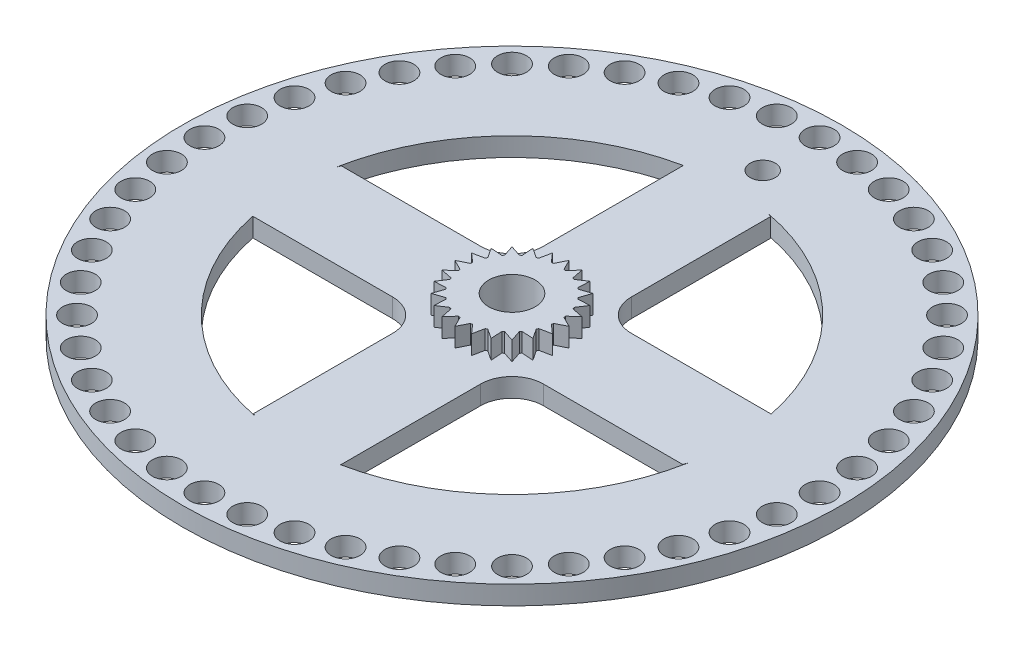
from build123d import *

# Parameters (mm, degrees)
SKETCH1_R               = 26.25
BOSS_EXTRUDE1_DEPTH     = 1.5
SKETCH2_R               = 17.5
CUT_EXTRUDE1_DEPTH      = 4.5
SKETCH3_R               = 1.15
CUT_EXTRUDE2_DEPTH      = 2.5
SKETCH5_R               = 1
CUT_EXTRUDE3_DEPTH      = 1.5
BOSS_EXTRUDE4_DEPTH     = 1.5
SKETCH12_R              = 3.75
BOSS_EXTRUDE6_DEPTH     = 1.5
CUT_EXTRUDE4_DEPTH      = 11
CUT_EXTRUDE4_DEPTH_BACK = 1.5
SKETCH7_R               = 1.85
BOSS_EXTRUDE8_DEPTH     = 1.5


with BuildPart() as part:
    # Sketch1 → Boss-Extrude1 (new body)
    with BuildSketch(Plane(origin=(0, 0, 0), x_dir=(1, 0, 0), z_dir=(0, 1, 0))):
        with Locations(Location((0, 0, 0), (0, 0, 270))):
            Circle(SKETCH1_R)
    extrude(amount=BOSS_EXTRUDE1_DEPTH)

    # Sketch2 → Cut-Extrude1 (cut)
    with BuildSketch(Plane(origin=(0, 1.5, 0), x_dir=(1, 0, 0), z_dir=(0, 1, 0))):
        with Locations(Location((0, 0, 0), (0, 0, 270))):
            Circle(SKETCH2_R)
    extrude(amount=-CUT_EXTRUDE1_DEPTH, mode=Mode.SUBTRACT)

    # Sketch3 → Cut-Extrude2 (cut)
    with BuildSketch(Plane(origin=(0, 1.5, 0), x_dir=(1, 0, 0), z_dir=(0, 1, 0))):
        with Locations(Location((0, 24.5, 0), (0, 0, 270))):
            Circle(SKETCH3_R)
        with Locations(Location((3.197891709, 24.290399104, 0), (0, 0, 270))):
            Circle(SKETCH3_R)
        with Locations(Location((6.341066605, 23.665182744, 0), (0, 0, 270))):
            Circle(SKETCH3_R)
        with Locations(Location((9.375744093, 22.635048547, 0), (0, 0, 270))):
            Circle(SKETCH3_R)
        with Locations(Location((12.25, 21.217622393, 0), (0, 0, 270))):
            Circle(SKETCH3_R)
        with Locations(Location((14.914655011, 19.437156837, 0), (0, 0, 270))):
            Circle(SKETCH3_R)
        with Locations(Location((17.324116139, 17.324116139, 0), (0, 0, 270))):
            Circle(SKETCH3_R)
        with Locations(Location((19.437156837, 14.914655011, 0), (0, 0, 270))):
            Circle(SKETCH3_R)
        with Locations(Location((21.217622393, 12.25, 0), (0, 0, 270))):
            Circle(SKETCH3_R)
        with Locations(Location((22.635048547, 9.375744093, 0), (0, 0, 270))):
            Circle(SKETCH3_R)
        with Locations(Location((23.665182744, 6.341066605, 0), (0, 0, 270))):
            Circle(SKETCH3_R)
        with Locations(Location((24.290399104, 3.197891709, 0), (0, 0, 270))):
            Circle(SKETCH3_R)
        with Locations(Location((24.5, 0, 0), (0, 0, 270))):
            Circle(SKETCH3_R)
        with Locations(Location((24.290399104, -3.197891709, 0), (0, 0, 270))):
            Circle(SKETCH3_R)
        with Locations(Location((23.665182744, -6.341066605, 0), (0, 0, 270))):
            Circle(SKETCH3_R)
        with Locations(Location((22.635048547, -9.375744093, 0), (0, 0, 270))):
            Circle(SKETCH3_R)
        with Locations(Location((21.217622393, -12.25, 0), (0, 0, 270))):
            Circle(SKETCH3_R)
        with Locations(Location((19.437156837, -14.914655011, 0), (0, 0, 270))):
            Circle(SKETCH3_R)
        with Locations(Location((17.324116139, -17.324116139, 0), (0, 0, 270))):
            Circle(SKETCH3_R)
        with Locations(Location((14.914655011, -19.437156837, 0), (0, 0, 270))):
            Circle(SKETCH3_R)
        with Locations(Location((12.25, -21.217622393, 0), (0, 0, 270))):
            Circle(SKETCH3_R)
        with Locations(Location((9.375744093, -22.635048547, 0), (0, 0, 270))):
            Circle(SKETCH3_R)
        with Locations(Location((6.341066605, -23.665182744, 0), (0, 0, 270))):
            Circle(SKETCH3_R)
        with Locations(Location((3.197891709, -24.290399104, 0), (0, 0, 270))):
            Circle(SKETCH3_R)
        with Locations(Location((0, -24.5, 0), (0, 0, 270))):
            Circle(SKETCH3_R)
        with Locations(Location((-3.197891709, -24.290399104, 0), (0, 0, 270))):
            Circle(SKETCH3_R)
        with Locations(Location((-6.341066605, -23.665182744, 0), (0, 0, 270))):
            Circle(SKETCH3_R)
        with Locations(Location((-9.375744093, -22.635048547, 0), (0, 0, 270))):
            Circle(SKETCH3_R)
        with Locations(Location((-12.25, -21.217622393, 0), (0, 0, 270))):
            Circle(SKETCH3_R)
        with Locations(Location((-14.914655011, -19.437156837, 0), (0, 0, 270))):
            Circle(SKETCH3_R)
        with Locations(Location((-17.324116139, -17.324116139, 0), (0, 0, 270))):
            Circle(SKETCH3_R)
        with Locations(Location((-19.437156837, -14.914655011, 0), (0, 0, 270))):
            Circle(SKETCH3_R)
        with Locations(Location((-21.217622393, -12.25, 0), (0, 0, 270))):
            Circle(SKETCH3_R)
        with Locations(Location((-22.635048547, -9.375744093, 0), (0, 0, 270))):
            Circle(SKETCH3_R)
        with Locations(Location((-23.665182744, -6.341066605, 0), (0, 0, 270))):
            Circle(SKETCH3_R)
        with Locations(Location((-24.290399104, -3.197891709, 0), (0, 0, 270))):
            Circle(SKETCH3_R)
        with Locations(Location((-24.5, 0, 0), (0, 0, 270))):
            Circle(SKETCH3_R)
        with Locations(Location((-24.290399104, 3.197891709, 0), (0, 0, 270))):
            Circle(SKETCH3_R)
        with Locations(Location((-23.665182744, 6.341066605, 0), (0, 0, 270))):
            Circle(SKETCH3_R)
        with Locations(Location((-22.635048547, 9.375744093, 0), (0, 0, 270))):
            Circle(SKETCH3_R)
        with Locations(Location((-21.217622393, 12.25, 0), (0, 0, 270))):
            Circle(SKETCH3_R)
        with Locations(Location((-19.437156837, 14.914655011, 0), (0, 0, 270))):
            Circle(SKETCH3_R)
        with Locations(Location((-17.324116139, 17.324116139, 0), (0, 0, 270))):
            Circle(SKETCH3_R)
        with Locations(Location((-14.914655011, 19.437156837, 0), (0, 0, 270))):
            Circle(SKETCH3_R)
        with Locations(Location((-12.25, 21.217622393, 0), (0, 0, 270))):
            Circle(SKETCH3_R)
        with Locations(Location((-9.375744093, 22.635048547, 0), (0, 0, 270))):
            Circle(SKETCH3_R)
        with Locations(Location((-6.341066605, 23.665182744, 0), (0, 0, 270))):
            Circle(SKETCH3_R)
        with Locations(Location((-3.197891709, 24.290399104, 0), (0, 0, 270))):
            Circle(SKETCH3_R)
    extrude(amount=-CUT_EXTRUDE2_DEPTH, mode=Mode.SUBTRACT)

    # Sketch5 → Cut-Extrude3 (cut)
    with BuildSketch(Plane(origin=(0, 1.5, 0), x_dir=(1, 0, 0), z_dir=(0, 1, 0))):
        with Locations(Location((0, 19.972095444, 0), (0, 0, 270))):
            Circle(SKETCH5_R)
    extrude(amount=-CUT_EXTRUDE3_DEPTH, mode=Mode.SUBTRACT)

    # Sketch6 → Boss-Extrude4 (add)
    with BuildSketch(Plane(origin=(0, 1.5, 0), x_dir=(1, 0, 0), z_dir=(0, 1, 0))):
        with BuildLine():
            Line((-3.5, 6), (-3.5, 17.146428199))
            Line((-3.5, 17.146428199), (0, 18.447450685))
            Line((0, 18.447450685), (3.5, 17.094189414))
            Line((3.5, 17.094189414), (3.5, 6))
            ThreePointArc((3.5, 6), (4.232233047, 4.232233047), (6, 3.5))
            Line((6, 3.5), (17.146428199, 3.5))
            Line((17.146428199, 3.5), (18.447450685, 0))
            Line((18.447450685, 0), (17.094189414, -3.5))
            Line((17.094189414, -3.5), (6, -3.5))
            ThreePointArc((6, -3.5), (4.232233047, -4.232233047), (3.5, -6))
            Line((3.5, -6), (3.5, -17.146428199))
            Line((3.5, -17.146428199), (0, -18.447450685))
            Line((0, -18.447450685), (-3.5, -17.094189414))
            Line((-3.5, -17.094189414), (-3.5, -6))
            ThreePointArc((-3.5, -6), (-4.232233047, -4.232233047), (-6, -3.5))
            Line((-6, -3.5), (-17.146428199, -3.5))
            Line((-17.146428199, -3.5), (-18.447450685, 0))
            Line((-18.447450685, 0), (-17.094189414, 3.5))
            Line((-17.094189414, 3.5), (-6, 3.5))
            ThreePointArc((-6, 3.5), (-4.232233047, 4.232233047), (-3.5, 6))
        make_face()
    extrude(amount=-BOSS_EXTRUDE4_DEPTH)

    # Sketch12 → Boss-Extrude6 (add)
    with BuildSketch(Plane(origin=(0, 1.5, 0), x_dir=(1, 0, 0), z_dir=(0, 1, 0))):
        with Locations(Location((0, 0, 0), (0, 0, 270))):
            Circle(SKETCH12_R)
    extrude(amount=BOSS_EXTRUDE6_DEPTH)

    # Sketch7 → Cut-Extrude4 (cut, two sides: drawn at the far end of the back side and taken through both)
    with BuildSketch(Plane(origin=(0, 1.5, 0), x_dir=(1, 0, 0), z_dir=(0, 1, 0)).offset(-CUT_EXTRUDE4_DEPTH_BACK)):
        with Locations(Location((0, 0, 0), (0, 0, 270))):
            Circle(SKETCH7_R)
    extrude(amount=CUT_EXTRUDE4_DEPTH + CUT_EXTRUDE4_DEPTH_BACK, mode=Mode.SUBTRACT)

    # Sketch15 → Boss-Extrude8 (add)
    with BuildSketch(Plane(origin=(0, 1.5, 0), x_dir=(1, 0, 0), z_dir=(0, 1, 0))):
        with BuildLine():
            Line((0.411312668, 3.727374664), (0, 4.55))
            Line((0, 4.55), (-0.411312668, 3.727374664))
            ThreePointArc((-0.411312668, 3.727374664), (0, 3.75), (0.411312668, 3.727374664))
        make_face()
        with BuildLine():
            Line((1.177626655, 4.39496251), (0.567418023, 3.706823005))
            ThreePointArc((0.567418023, 3.706823005), (0.970571419, 3.622221849), (1.36201308, 3.493911901))
            Line((1.36201308, 3.493911901), (1.177626655, 4.39496251))
        make_face()
        with BuildLine():
            ThreePointArc((-1.36201308, 3.493911901), (-0.970571419, 3.622221849), (-0.567418023, 3.706823005))
            Line((-0.567418023, 3.706823005), (-1.177626655, 4.39496251))
            Line((-1.177626655, 4.39496251), (-1.36201308, 3.493911901))
        make_face()
        with BuildLine():
            Line((2.275, 3.940415587), (1.507480113, 3.433657483))
            ThreePointArc((1.507480113, 3.433657483), (1.875, 3.247595264), (2.219894551, 3.022344815))
            Line((2.219894551, 3.022344815), (2.275, 3.940415587))
        make_face()
        with BuildLine():
            ThreePointArc((-2.219894551, 3.022344815), (-1.875, 3.247595264), (-1.507480113, 3.433657483))
            Line((-1.507480113, 3.433657483), (-2.275, 3.940415587))
            Line((-2.275, 3.940415587), (-2.219894551, 3.022344815))
        make_face()
        with BuildLine():
            Line((3.217335854, 3.217335854), (2.344809925, 2.926493878))
            ThreePointArc((2.344809925, 2.926493878), (2.651650429, 2.651650429), (2.926493878, 2.344809925))
            Line((2.926493878, 2.344809925), (3.217335854, 3.217335854))
        make_face()
        with BuildLine():
            ThreePointArc((-2.926493878, 2.344809925), (-2.651650429, 2.651650429), (-2.344809925, 2.926493878))
            Line((-2.344809925, 2.926493878), (-3.217335854, 3.217335854))
            Line((-3.217335854, 3.217335854), (-2.926493878, 2.344809925))
        make_face()
        with BuildLine():
            Line((3.940415587, 2.275), (3.022344815, 2.219894551))
            ThreePointArc((3.022344815, 2.219894551), (3.247595264, 1.875), (3.433657483, 1.507480113))
            Line((3.433657483, 1.507480113), (3.940415587, 2.275))
        make_face()
        with BuildLine():
            ThreePointArc((-3.433657483, 1.507480113), (-3.247595264, 1.875), (-3.022344815, 2.219894551))
            Line((-3.022344815, 2.219894551), (-3.940415587, 2.275))
            Line((-3.940415587, 2.275), (-3.433657483, 1.507480113))
        make_face()
        with BuildLine():
            Line((4.39496251, 1.177626655), (3.493911901, 1.36201308))
            ThreePointArc((3.493911901, 1.36201308), (3.622221849, 0.970571419), (3.706823005, 0.567418023))
            Line((3.706823005, 0.567418023), (4.39496251, 1.177626655))
        make_face()
        with BuildLine():
            ThreePointArc((-3.706823005, 0.567418023), (-3.622221849, 0.970571419), (-3.493911901, 1.36201308))
            Line((-3.493911901, 1.36201308), (-4.39496251, 1.177626655))
            Line((-4.39496251, 1.177626655), (-3.706823005, 0.567418023))
        make_face()
        with BuildLine():
            Line((4.55, 0), (3.727374664, 0.411312668))
            ThreePointArc((3.727374664, 0.411312668), (3.75, 0), (3.727374664, -0.411312668))
            Line((3.727374664, -0.411312668), (4.55, 0))
        make_face()
        with BuildLine():
            ThreePointArc((-3.727374664, -0.411312668), (-3.75, 0), (-3.727374664, 0.411312668))
            Line((-3.727374664, 0.411312668), (-4.55, 0))
            Line((-4.55, 0), (-3.727374664, -0.411312668))
        make_face()
        with BuildLine():
            ThreePointArc((-3.493911901, -1.36201308), (-3.622221849, -0.970571419), (-3.706823005, -0.567418023))
            Line((-3.706823005, -0.567418023), (-4.39496251, -1.177626655))
            Line((-4.39496251, -1.177626655), (-3.493911901, -1.36201308))
        make_face()
        with BuildLine():
            Line((4.39496251, -1.177626655), (3.706823005, -0.567418023))
            ThreePointArc((3.706823005, -0.567418023), (3.622221849, -0.970571419), (3.493911901, -1.36201308))
            Line((3.493911901, -1.36201308), (4.39496251, -1.177626655))
        make_face()
        with BuildLine():
            ThreePointArc((-3.022344815, -2.219894551), (-3.247595264, -1.875), (-3.433657483, -1.507480113))
            Line((-3.433657483, -1.507480113), (-3.940415587, -2.275))
            Line((-3.940415587, -2.275), (-3.022344815, -2.219894551))
        make_face()
        with BuildLine():
            Line((3.940415587, -2.275), (3.433657483, -1.507480113))
            ThreePointArc((3.433657483, -1.507480113), (3.247595264, -1.875), (3.022344815, -2.219894551))
            Line((3.022344815, -2.219894551), (3.940415587, -2.275))
        make_face()
        with BuildLine():
            ThreePointArc((-2.344809925, -2.926493878), (-2.651650429, -2.651650429), (-2.926493878, -2.344809925))
            Line((-2.926493878, -2.344809925), (-3.217335854, -3.217335854))
            Line((-3.217335854, -3.217335854), (-2.344809925, -2.926493878))
        make_face()
        with BuildLine():
            Line((3.217335854, -3.217335854), (2.926493878, -2.344809925))
            ThreePointArc((2.926493878, -2.344809925), (2.651650429, -2.651650429), (2.344809925, -2.926493878))
            Line((2.344809925, -2.926493878), (3.217335854, -3.217335854))
        make_face()
        with BuildLine():
            ThreePointArc((-1.507480113, -3.433657483), (-1.875, -3.247595264), (-2.219894551, -3.022344815))
            Line((-2.219894551, -3.022344815), (-2.275, -3.940415587))
            Line((-2.275, -3.940415587), (-1.507480113, -3.433657483))
        make_face()
        with BuildLine():
            Line((2.275, -3.940415587), (2.219894551, -3.022344815))
            ThreePointArc((2.219894551, -3.022344815), (1.875, -3.247595264), (1.507480113, -3.433657483))
            Line((1.507480113, -3.433657483), (2.275, -3.940415587))
        make_face()
        with BuildLine():
            ThreePointArc((-0.567418023, -3.706823005), (-0.970571419, -3.622221849), (-1.36201308, -3.493911901))
            Line((-1.36201308, -3.493911901), (-1.177626655, -4.39496251))
            Line((-1.177626655, -4.39496251), (-0.567418023, -3.706823005))
        make_face()
        with BuildLine():
            Line((1.177626655, -4.39496251), (1.36201308, -3.493911901))
            ThreePointArc((1.36201308, -3.493911901), (0.970571419, -3.622221849), (0.567418023, -3.706823005))
            Line((0.567418023, -3.706823005), (1.177626655, -4.39496251))
        make_face()
        with BuildLine():
            ThreePointArc((0.411312668, -3.727374664), (0, -3.75), (-0.411312668, -3.727374664))
            Line((-0.411312668, -3.727374664), (0, -4.55))
            Line((0, -4.55), (0.411312668, -3.727374664))
        make_face()
    extrude(amount=BOSS_EXTRUDE8_DEPTH)


solid = part.part
